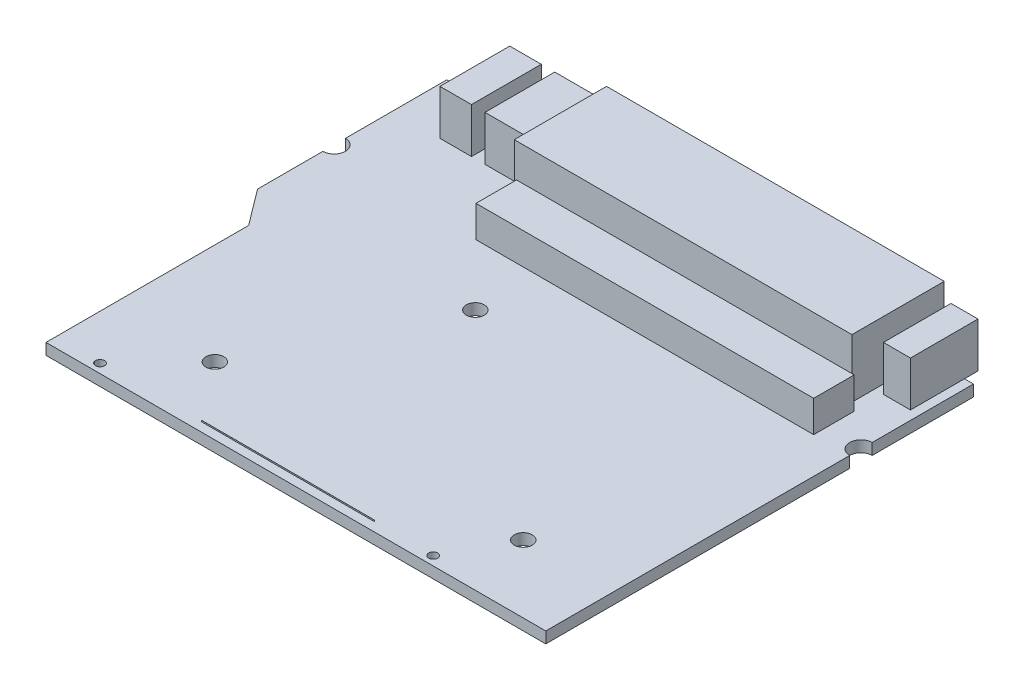
from build123d import *

# Parameters (mm, degrees)
BOSS_EXTRUDE1_DEPTH = 2.5
SKETCH2_R           = 2
SKETCH2_R_2         = 1
CUT_EXTRUDE1_DEPTH  = 5
BOSS_EXTRUDE2_DEPTH = 13
SKETCH6_W           = 75
SKETCH6_H           = 9
BOSS_EXTRUDE3_DEPTH = 7
BOSS_EXTRUDE4_DEPTH = 10
SKETCH8_W           = 38.5
SKETCH8_H           = 0.01
BOSS_EXTRUDE5_DEPTH = 0.3


with BuildPart() as part:
    # Sketch1 → Boss-Extrude1 (new body)
    with BuildSketch(Plane(origin=(0, 0, 0), x_dir=(1, 0, 0), z_dir=(0, 1, 0))):
        with BuildLine():
            Line((-58.5, 47.5), (58.5, 47.5))
            Line((58.5, 47.5), (58.5, 25))
            ThreePointArc((58.5, 25), (56, 22.5), (58.5, 20))
            Line((58.5, 20), (58.5, -47.5))
            Line((58.5, -47.5), (-52.5, -47.5))
            Line((-52.5, -47.5), (-52.5, -2.5))
            Line((-52.5, -2.5), (-58.5, 5.5))
            Line((-58.5, 5.5), (-58.5, 20))
            ThreePointArc((-58.5, 20), (-56, 22.5), (-58.5, 25))
            Line((-58.5, 25), (-58.5, 47.5))
        make_face()
    extrude(amount=BOSS_EXTRUDE1_DEPTH)

    # Sketch2 → Cut-Extrude1 (cut)
    with BuildSketch(Plane(origin=(0, 2.5, 0), x_dir=(1, 0, 0), z_dir=(0, 1, 0))):
        with Locations(Location((-11.054054054, 6.409494198, 0), (0, 0, 270))):
            Circle(SKETCH2_R)
        with Locations(Location((-30, -32.5, 0), (0, 0, 270))):
            Circle(SKETCH2_R)
        with Locations(Location((38.5, -32.5, 0), (0, 0, 270))):
            Circle(SKETCH2_R)
        with Locations(Location((-42.5, -45.5, 0), (0, 0, 270))):
            Circle(SKETCH2_R_2)
        with Locations(Location((31.5, -45.5, 0), (0, 0, 270))):
            Circle(SKETCH2_R_2)
    extrude(amount=-CUT_EXTRUDE1_DEPTH, mode=Mode.SUBTRACT)

    # Sketch3 → Boss-Extrude2 (add)
    with BuildSketch(Plane(origin=(0, 2.5, 0), x_dir=(1, 0, 0), z_dir=(0, 1, 0))):
        Polygon((-26.5, 47.5), (-26.5, 30.5), (48.5, 30.5), (48.5, 47.5), (48.5, 51), (-26.5, 51), align=None)
    extrude(amount=BOSS_EXTRUDE2_DEPTH)

    # Sketch6 → Boss-Extrude3 (add)
    with BuildSketch(Plane(origin=(0, 2.5, 0), x_dir=(1, 0, 0), z_dir=(0, 1, 0))):
        with Locations((13, 24.5)):
            Rectangle(SKETCH6_W, SKETCH6_H)
    extrude(amount=BOSS_EXTRUDE3_DEPTH)

    # Sketch7 → Boss-Extrude4 (add)
    with BuildSketch(Plane(origin=(0, 2.5, 0), x_dir=(1, 0, 0), z_dir=(0, 1, 0))):
        Polygon((50.5, 47.5), (50.5, 35.5), (56.5, 35.5), (56.5, 47.5), (56.5, 50.5), (50.5, 50.5), align=None)
        Polygon((-29.5, 47.5), (-29.5, 35.5), (-38, 35.5), (-38, 47.5), (-38, 51), (-29.5, 51), align=None)
        Polygon((-41, 35.5), (-48, 35.5), (-48, 47.5), (-48, 51), (-41, 51), (-41, 47.5), align=None)
    extrude(amount=BOSS_EXTRUDE4_DEPTH)

    # Sketch8 → Boss-Extrude5 (add)
    with BuildSketch(Plane(origin=(0, 2.5, 0), x_dir=(1, 0, 0), z_dir=(0, 1, 0))):
        with Locations((-0.75, -45.495)):
            Rectangle(SKETCH8_W, SKETCH8_H)
    extrude(amount=BOSS_EXTRUDE5_DEPTH)


solid = part.part
